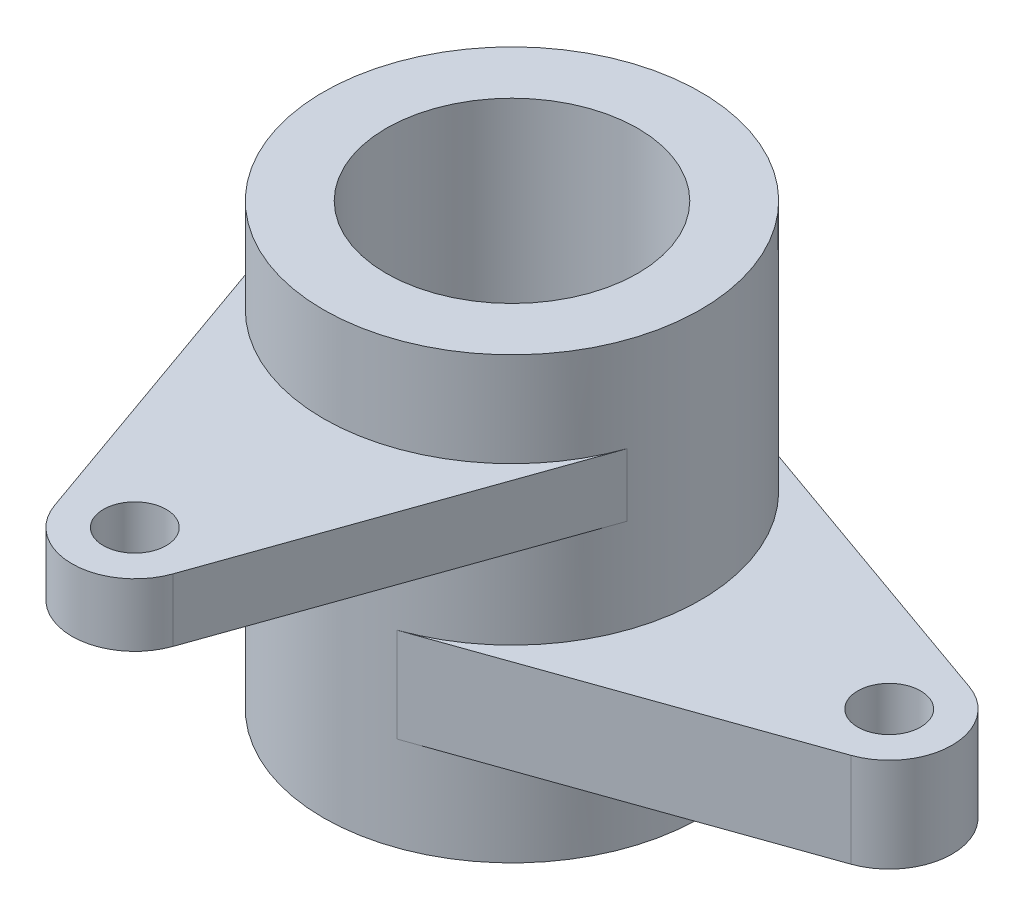
from build123d import *

# Parameters (mm, degrees)
SKETCH2_R           = 30
SKETCH2_R_2         = 20
BOSS_EXTRUDE1_DEPTH = 70
SKETCH4_R           = 5
BOSS_EXTRUDE2_DEPTH = 15
SKETCH5_R           = 5
BOSS_EXTRUDE3_DEPTH = 10


with BuildPart() as part:
    # Sketch2 → Boss-Extrude1 (new body)
    with BuildSketch(Plane(origin=(0, 0, 0), x_dir=(1, 0, 0), z_dir=(0, 1, 0))):
        with Locations(Location((0, 0, 0), (0, 0, 270))):
            Circle(SKETCH2_R)
        with Locations(Location((0, 0, 0), (0, 0, 270))):
            Circle(SKETCH2_R_2, mode=Mode.SUBTRACT)
    extrude(amount=BOSS_EXTRUDE1_DEPTH)

    # Sketch4 → Boss-Extrude2 (add)
    with BuildSketch(Plane(origin=(0, 15, 0), x_dir=(1, 0, 0), z_dir=(0, 1, 0))):
        with BuildLine():
            Line((63.333333333, 9.428090416), (10, 28.284271247))
            ThreePointArc((10, 28.284271247), (30, 0), (10, -28.284271247))
            Line((10, -28.284271247), (63.333333333, -9.428090416))
            ThreePointArc((63.333333333, -9.428090416), (70, 0), (63.333333333, 9.428090416))
        make_face()
        with Locations(Location((60, 0, 0), (0, 0, 270))):
            Circle(SKETCH4_R, mode=Mode.SUBTRACT)
    extrude(amount=BOSS_EXTRUDE2_DEPTH)

    # Sketch5 → Boss-Extrude3 (add)
    with BuildSketch(Plane(origin=(0, 45, 0), x_dir=(1, 0, 0), z_dir=(0, 1, 0))):
        with BuildLine():
            Line((-9.428090416, -63.333333333), (-28.284271247, -10))
            ThreePointArc((-28.284271247, -10), (0, -30), (28.284271247, -10))
            Line((28.284271247, -10), (9.428090416, -63.333333333))
            ThreePointArc((9.428090416, -63.333333333), (0, -70), (-9.428090416, -63.333333333))
        make_face()
        with Locations(Location((0, -60, 0), (0, 0, 270))):
            Circle(SKETCH5_R, mode=Mode.SUBTRACT)
    extrude(amount=BOSS_EXTRUDE3_DEPTH)


solid = part.part
